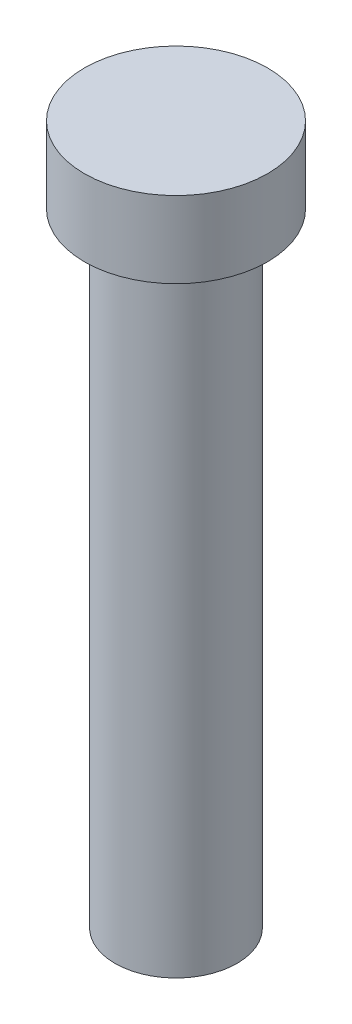
from build123d import *

# Parameters (mm, degrees)
SKETCH1_R           = 4
BOSS_EXTRUDE1_DEPTH = 40.8
SKETCH2_R           = 6
BOSS_EXTRUDE2_DEPTH = 5
SKETCH3_R           = 1.5
CUT_EXTRUDE1_DEPTH  = 15


with BuildPart() as part:
    # Sketch1 → Boss-Extrude1 (new body)
    with BuildSketch(Plane(origin=(0, 0, 0), x_dir=(1, 0, 0), z_dir=(0, 1, 0))):
        with Locations(Location((0, 0, 0), (0, 0, 270))):
            Circle(SKETCH1_R)
    extrude(amount=BOSS_EXTRUDE1_DEPTH)

    # Sketch2 → Boss-Extrude2 (add)
    with BuildSketch(Plane(origin=(0, 40.8, 0), x_dir=(1, 0, 0), z_dir=(0, 1, 0))):
        with Locations(Location((0, 0, 0), (0, 0, 270))):
            Circle(SKETCH2_R)
    extrude(amount=BOSS_EXTRUDE2_DEPTH)

    # Sketch3 → Cut-Extrude1 (cut)
    with BuildSketch(Plane.XZ):
        with Locations(Location((0, 0, 0), (0, 0, 270))):
            Circle(SKETCH3_R)
    extrude(amount=-CUT_EXTRUDE1_DEPTH, mode=Mode.SUBTRACT)


solid = part.part
